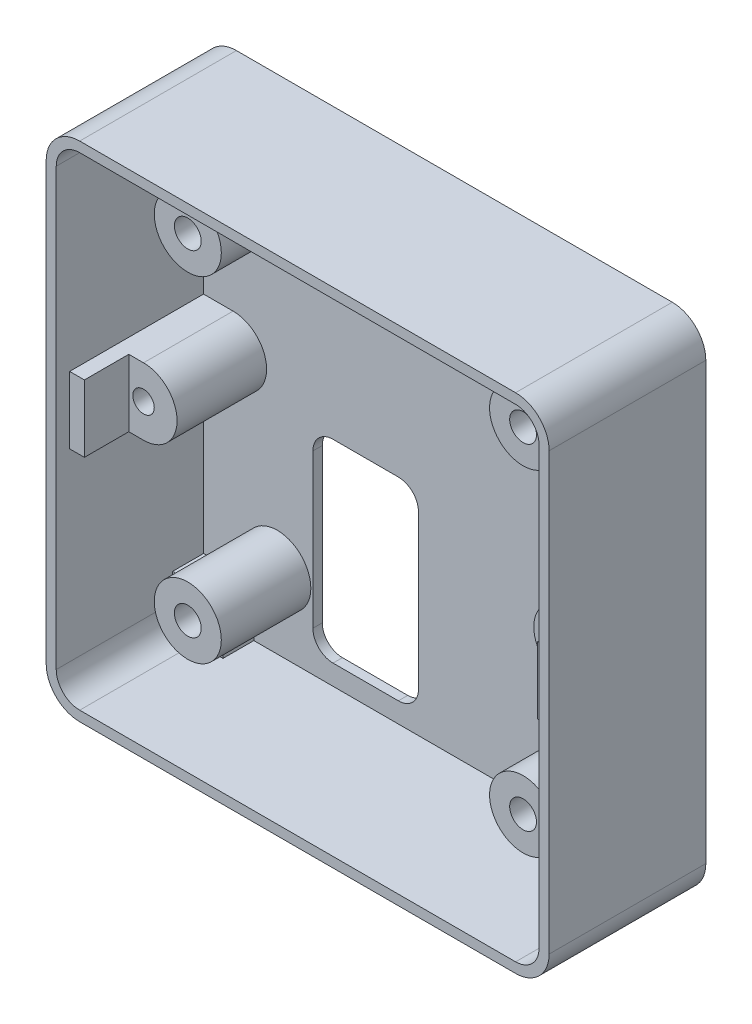
from build123d import *

# Parameters (mm, degrees)
SIDES_START         = -14.970203
SIDES_DEPTH         = 21.970205
BOSS_EXTRUDE2_START = -16.370201
SKETCH1_3_R         = 1.6
BOSS_EXTRUDE2_DEPTH = 1.4
BOSS_EXTRUDE3_START = -16.370203
SKETCH1_4_R         = 1.6
BOSS_EXTRUDE3_DEPTH = 6.000003
BOSS_EXTRUDE4_START = -1.619402
SKETCH1_5_R         = 4.998410694
SKETCH1_5_R_2       = 5.00000078
SKETCH1_5_R_3       = 4.998409474
SKETCH1_5_R_4       = 2
BOSS_EXTRUDE4_DEPTH = 14.75080016
CUT_EXTRUDE1_START  = -7.619402
SKETCH1_6_R         = 2
CUT_EXTRUDE1_DEPTH  = 6
BOSS_EXTRUDE5_START = -1.619402
SKETCH2_R           = 1.6
SKETCH2_W           = 2.2
SKETCH2_H           = 10
BOSS_EXTRUDE5_DEPTH = 13.350799067
BOSS_EXTRUDE6_START = -14.9702
SKETCH2_3_W         = 2.2
SKETCH2_3_H         = 10
BOSS_EXTRUDE6_DEPTH = 19.9702
CUT_EXTRUDE2_START  = -3e-06
CUT_EXTRUDE2_DEPTH  = 23.370208


with BuildPart() as part:
    # Sketch1 → sides (new body)
    with BuildSketch(Plane.XY.offset(SIDES_START)):
        with BuildLine():
            ThreePointArc((-7.5, 62.5), (-6.035533906, 66.035533906), (-2.5, 67.5))
            Line((-2.5, 67.5), (62.5, 67.5))
            ThreePointArc((62.5, 67.5), (66.035533906, 66.035533906), (67.5, 62.5))
            Line((67.5, 62.5), (67.5, -2.5))
            ThreePointArc((67.5, -2.5), (66.035533906, -6.035533906), (62.5, -7.5))
            Line((62.5, -7.5), (-2.5, -7.5))
            ThreePointArc((-2.5, -7.5), (-6.035533906, -6.035533906), (-7.5, -2.5))
            Line((-7.5, -2.5), (-7.5, 62.5))
        make_face()
        with BuildLine():
            ThreePointArc((66, 62.5), (64.974873734, 64.974873734), (62.5, 66))
            Line((62.5, 66), (61, 66))
            Line((61, 66), (-1, 66))
            Line((-1, 66), (-2.5, 66))
            ThreePointArc((-2.5, 66), (-4.974873734, 64.974873734), (-6, 62.5))
            Line((-6, 62.5), (-6, 61.010980342))
            Line((-6, 61.010980342), (-6, -1))
            Line((-6, -1), (-6, -2.5))
            ThreePointArc((-6, -2.5), (-4.974873734, -4.974873734), (-2.5, -6))
            Line((-2.5, -6), (-1, -6))
            Line((-1, -6), (61, -6))
            Line((61, -6), (62.5, -6))
            ThreePointArc((62.5, -6), (64.974873734, -4.974873734), (66, -2.5))
            Line((66, -2.5), (66, -1))
            Line((66, -1), (66, 61.010980342))
            Line((66, 61.010980342), (66, 62.5))
        make_face(mode=Mode.SUBTRACT)
    extrude(amount=SIDES_DEPTH)

    # Sketch1<3> → Boss-Extrude2 (add)
    with BuildSketch(Plane.XY.offset(BOSS_EXTRUDE2_START)):
        with BuildLine():
            Line((67.5, 62.5), (67.5, -2.5))
            ThreePointArc((67.5, -2.5), (66.035533906, -6.035533906), (62.5, -7.5))
            Line((62.5, -7.5), (-2.5, -7.5))
            ThreePointArc((-2.5, -7.5), (-6.035533906, -6.035533906), (-7.5, -2.5))
            Line((-7.5, -2.5), (-7.5, 62.5))
            ThreePointArc((-7.5, 62.5), (-6.035533906, 66.035533906), (-2.5, 67.5))
            Line((-2.5, 67.5), (62.5, 67.5))
            ThreePointArc((62.5, 67.5), (66.035533906, 66.035533906), (67.5, 62.5))
        make_face()
        with Locations((-2.5, 62.5)):
            Circle(SKETCH1_3_R, mode=Mode.SUBTRACT)
        with Locations((62.5, 62.5)):
            Circle(SKETCH1_3_R, mode=Mode.SUBTRACT)
        with Locations((-2.5, -2.5)):
            Circle(SKETCH1_3_R, mode=Mode.SUBTRACT)
        with Locations((62.5, -2.5)):
            Circle(SKETCH1_3_R, mode=Mode.SUBTRACT)
    extrude(amount=BOSS_EXTRUDE2_DEPTH)

    # Sketch1<4> → Boss-Extrude3 (add)
    # profile 1 of 4: a face of its own
    with BuildSketch(Plane.XY.offset(BOSS_EXTRUDE3_START)):
        with BuildLine():
            ThreePointArc((66, 62.5), (64.974873734, 64.974873734), (62.5, 66))
            Line((62.5, 66), (58.5, 66))
            Line((58.5, 66), (58.5, 62.5))
            ThreePointArc((58.5, 62.5), (59.671572875, 59.671572875), (62.5, 58.5))
            Line((62.5, 58.5), (66, 58.5))
            Line((66, 58.5), (66, 62.5))
        make_face()
        with Locations((62.5, 62.5)):
            Circle(SKETCH1_4_R, mode=Mode.SUBTRACT)
    # profile 2 of 4: a face of its own
    with BuildSketch(Plane.XY.offset(BOSS_EXTRUDE3_START)):
        with BuildLine():
            Line((1.5, 62.5), (1.5, 66))
            Line((1.5, 66), (-2.5, 66))
            ThreePointArc((-2.5, 66), (-4.974873734, 64.974873734), (-6, 62.5))
            Line((-6, 62.5), (-6, 58.5))
            Line((-6, 58.5), (-2.5, 58.5))
            ThreePointArc((-2.5, 58.5), (0.328427125, 59.671572875), (1.5, 62.5))
        make_face()
        with Locations((-2.5, 62.5)):
            Circle(SKETCH1_4_R, mode=Mode.SUBTRACT)
    # profile 3 of 4: a face of its own
    with BuildSketch(Plane.XY.offset(BOSS_EXTRUDE3_START)):
        with BuildLine():
            Line((66, -2.5), (66, 1.5))
            Line((66, 1.5), (62.5, 1.5))
            ThreePointArc((62.5, 1.5), (59.671572875, 0.328427125), (58.5, -2.5))
            Line((58.5, -2.5), (58.5, -6))
            Line((58.5, -6), (62.5, -6))
            ThreePointArc((62.5, -6), (64.974873734, -4.974873734), (66, -2.5))
        make_face()
        with Locations((62.5, -2.5)):
            Circle(SKETCH1_4_R, mode=Mode.SUBTRACT)
    # profile 4 of 4: a face of its own
    with BuildSketch(Plane.XY.offset(BOSS_EXTRUDE3_START)):
        with BuildLine():
            Line((-2.5, 1.5), (-6, 1.5))
            Line((-6, 1.5), (-6, -2.5))
            ThreePointArc((-6, -2.5), (-4.974873734, -4.974873734), (-2.5, -6))
            Line((-2.5, -6), (1.5, -6))
            Line((1.5, -6), (1.5, -2.5))
            ThreePointArc((1.5, -2.5), (0.328427125, 0.328427125), (-2.5, 1.5))
        make_face()
        with Locations((-2.5, -2.5)):
            Circle(SKETCH1_4_R, mode=Mode.SUBTRACT)
    extrude(amount=BOSS_EXTRUDE3_DEPTH)

    # Sketch1<5> → Boss-Extrude4 (add)
    with BuildSketch(Plane.XY.offset(BOSS_EXTRUDE4_START)):
        with Locations((55.001589559, 4.998410441)):
            Circle(SKETCH1_5_R)
        with Locations((54.99999922, 54.99999922)):
            Circle(SKETCH1_5_R_2)
        with Locations((5.00000016, 54.99999922)):
            Circle(SKETCH1_5_R_2)
        with Locations((4.998409221, 4.998409221)):
            Circle(SKETCH1_5_R_3)
        with Locations((4.998409221, 4.998409221)):
            Circle(SKETCH1_5_R_4)
        with Locations((55.001589559, 4.998410441)):
            Circle(SKETCH1_5_R_4)
        with Locations((54.99999922, 54.99999922)):
            Circle(SKETCH1_5_R_4)
        with Locations((5.00000016, 54.99999922)):
            Circle(SKETCH1_5_R_4)
    extrude(amount=-BOSS_EXTRUDE4_DEPTH)

    # Sketch1<6> → Cut-Extrude1 (cut)
    with BuildSketch(Plane.XY.offset(CUT_EXTRUDE1_START)):
        with Locations((4.998409221, 4.998409221)):
            Circle(SKETCH1_6_R)
        with Locations((55.001589559, 4.998410441)):
            Circle(SKETCH1_6_R)
        with Locations((54.99999922, 54.99999922)):
            Circle(SKETCH1_6_R)
        with Locations((5.00000016, 54.99999922)):
            Circle(SKETCH1_6_R)
    extrude(amount=CUT_EXTRUDE1_DEPTH, mode=Mode.SUBTRACT)

    # Sketch2 → Boss-Extrude5 (add)
    # profile 1 of 4: a face of its own
    with BuildSketch(Plane.XY.offset(BOSS_EXTRUDE5_START)):
        with BuildLine():
            ThreePointArc((-1.6, 25), (3.4, 30), (-1.6, 35))
            Line((-1.6, 35), (-3.8, 35))
            Line((-3.8, 35), (-3.8, 25))
            Line((-3.8, 25), (-1.6, 25))
        make_face()
        with Locations((-1.6, 30)):
            Circle(SKETCH2_R, mode=Mode.SUBTRACT)
    # profile 2 of 4: a face of its own
    with BuildSketch(Plane.XY.offset(BOSS_EXTRUDE5_START)):
        with Locations((-4.9, 30)):
            Rectangle(SKETCH2_W, SKETCH2_H)
    # profile 3 of 4: a face of its own
    with BuildSketch(Plane.XY.offset(BOSS_EXTRUDE5_START)):
        with BuildLine():
            Line((63.8, 35), (61.6, 35))
            ThreePointArc((61.6, 35), (56.6, 30), (61.6, 25))
            Line((61.6, 25), (63.8, 25))
            Line((63.8, 25), (63.8, 35))
        make_face()
        with Locations((61.6, 30)):
            Circle(SKETCH2_R, mode=Mode.SUBTRACT)
    # profile 4 of 4: a face of its own
    with BuildSketch(Plane.XY.offset(BOSS_EXTRUDE5_START)):
        with Locations((64.9, 30)):
            Rectangle(SKETCH2_W, SKETCH2_H)
    extrude(amount=-BOSS_EXTRUDE5_DEPTH)

    # Sketch2<3> → Boss-Extrude6 (add)
    with BuildSketch(Plane.XY.offset(BOSS_EXTRUDE6_START)):
        with Locations((-4.9, 30)):
            Rectangle(SKETCH2_3_W, SKETCH2_3_H)
        with Locations((64.9, 30)):
            Rectangle(SKETCH2_3_W, SKETCH2_3_H)
    extrude(amount=BOSS_EXTRUDE6_DEPTH)

    # Sketch3 → Cut-Extrude2 (cut)
    with BuildSketch(Plane(origin=(0, 7.16e-07, -16.370202778), x_dir=(1, 0, 0), z_dir=(4.178627238637217e-15, -4.371140900000003e-08, 0.999999999999999)).offset(CUT_EXTRUDE2_START)):
        with BuildLine():
            Line((23.053327071, 25.897848181), (13.305327071, 25.897848181))
            ThreePointArc((13.305327071, 25.897848181), (11.184006728, 25.019168525), (10.305327071, 22.897848181))
            Line((10.305327071, 22.897848181), (10.305327071, 3.06e-07))
            ThreePointArc((10.305327071, 3.06e-07), (11.184006728, -2.121320038), (13.305327071, -2.999999694))
            Line((13.305327071, -2.999999694), (23.053327071, -2.999999694))
            ThreePointArc((23.053327071, -2.999999694), (25.174647415, -2.121320038), (26.053327071, 3.06e-07))
            Line((26.053327071, 3.06e-07), (26.053327071, 22.897848181))
            ThreePointArc((26.053327071, 22.897848181), (25.174647415, 25.019168525), (23.053327071, 25.897848181))
        make_face()
    extrude(amount=CUT_EXTRUDE2_DEPTH, mode=Mode.SUBTRACT)


solid = part.part
